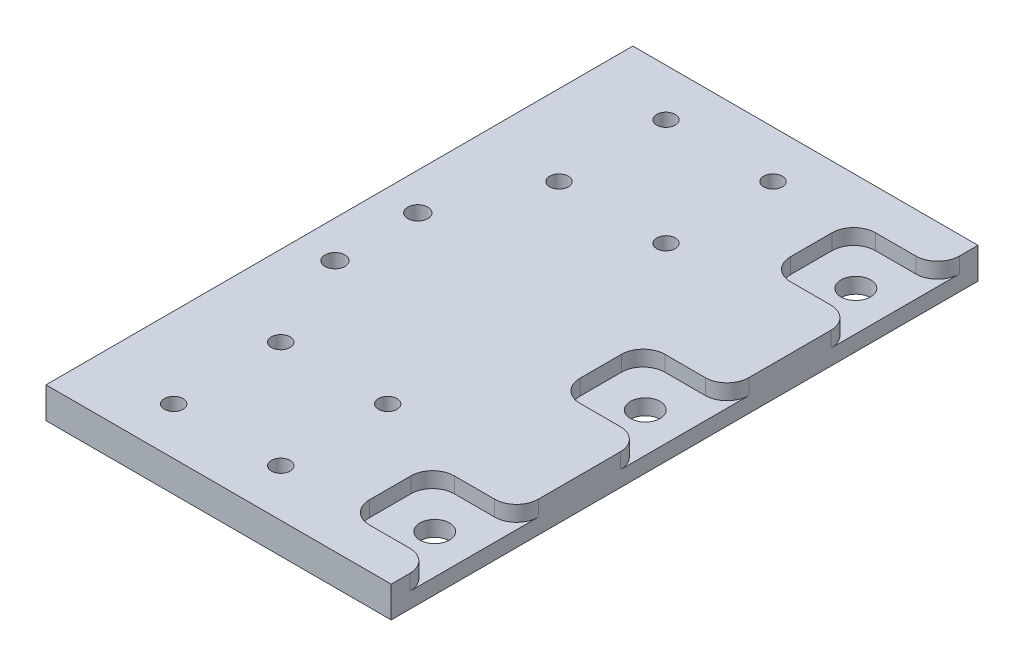
from build123d import *

# Parameters (mm, degrees)
SKETCH1_W                       = 50
SKETCH1_H                       = 95
BOSS_EXTRUDE1_DEPTH             = 2.25
M2_5_CLEARANCE_HOLE1_AT_2_COUNT = 2
M2_5_CLEARANCE_HOLE1_AT_2_PITCH = 15.5
M2_5_CLEARANCE_HOLE1_AT_3_COUNT = 2
M2_5_CLEARANCE_HOLE1_AT_3_PITCH = 21.920310217
M2_5_CLEARANCE_HOLE1_AT_4_COUNT = 2
M2_5_CLEARANCE_HOLE1_AT_4_PITCH = 15.5
SKETCH4_W                       = 50
SKETCH4_H                       = 5
CUT_EXTRUDE1_DEPTH              = 54.865573421
CUT_EXTRUDE2_DEPTH              = 2.25
M4_CLEARANCE_HOLE1_D            = 4.3
M4_CLEARANCE_HOLE1_DEPTH        = 10.1
M4_CLEARANCE_HOLE1_TIP          = 1.291850331
FILLET1_R                       = 3.1524
M2_5_CLEARANCE_HOLE2_D          = 2.9


with BuildPart() as part:
    # Sketch1 → Boss-Extrude1 (new, symmetric)
    with BuildSketch(Plane(origin=(0, 0, 0), x_dir=(1, 0, 0), z_dir=(0, 1, 0))):
        Rectangle(SKETCH1_W, SKETCH1_H)
    extrude(amount=BOSS_EXTRUDE1_DEPTH, both=True)

    # Sketch3 → M2.5 Clearance Hole1 (revolve, cut)
    with BuildSketch(Plane(origin=(2.15, 2.25, 20.15), x_dir=(0, 0, 1), z_dir=(1, 0, 0))):
        Polygon((0, 0), (0, 7.161161836), (1.35, 6.35), (1.35, 0), align=None)
    m2_5_clearance_hole1 = revolve(axis=Axis((2.15, 8.6, 20.15), (0, -1, 0)), mode=Mode.SUBTRACT)

    # M2.5 Clearance Hole1 at 2: M2.5 Clearance Hole1 ×2
    with Locations(*[(0, 0, i * M2_5_CLEARANCE_HOLE1_AT_2_PITCH) for i in range(1, M2_5_CLEARANCE_HOLE1_AT_2_COUNT)]):
        add(m2_5_clearance_hole1, mode=Mode.SUBTRACT)

    # M2.5 Clearance Hole1 at 3: M2.5 Clearance Hole1 ×2
    with Locations(*[Vector(-0.7071067811865477, 0, 0.7071067811865475) * (i * M2_5_CLEARANCE_HOLE1_AT_3_PITCH) for i in range(1, M2_5_CLEARANCE_HOLE1_AT_3_COUNT)]):
        add(m2_5_clearance_hole1, mode=Mode.SUBTRACT)

    # M2.5 Clearance Hole1 at 4: M2.5 Clearance Hole1 ×2
    with Locations(*[(-i * M2_5_CLEARANCE_HOLE1_AT_4_PITCH, 0, 0) for i in range(1, M2_5_CLEARANCE_HOLE1_AT_4_COUNT)]):
        add(m2_5_clearance_hole1, mode=Mode.SUBTRACT)

    # Sketch4 → Cut-Extrude1 (cut, through all)
    with BuildSketch(Plane(origin=(0, 2.25, 0), x_dir=(1, 0, 0), z_dir=(0, 1, 0))):
        with Locations((0, -45)):
            Rectangle(SKETCH4_W, SKETCH4_H)
    cut_extrude1 = extrude(amount=-CUT_EXTRUDE1_DEPTH, mode=Mode.SUBTRACT)

    # Mirror1: M2.5 Clearance Hole1, Cut-Extrude1 across plane
    add(m2_5_clearance_hole1.mirror(Plane.XY), mode=Mode.SUBTRACT)
    add(cut_extrude1.mirror(Plane.XY), mode=Mode.SUBTRACT)

    # Mirror1 copy 1 sketch → Mirror1 copy 1 (revolve, cut)
    with BuildSketch(Plane(origin=(2.15, 2.25, -35.65), x_dir=(0, 0, -1), z_dir=(1, 0, 0))):
        Polygon((0, 0), (0, -7.161161836), (1.35, -6.35), (1.35, 0), align=None)
    revolve(axis=Axis((2.15, 8.6, -35.65), (0, 1, 0)), mode=Mode.SUBTRACT)

    # Mirror1 copy 2 sketch → Mirror1 copy 2 (revolve, cut)
    with BuildSketch(Plane(origin=(-13.35, 2.25, -35.65), x_dir=(0, 0, -1), z_dir=(1, 0, 0))):
        Polygon((0, 0), (0, -7.161161836), (1.35, -6.35), (1.35, 0), align=None)
    revolve(axis=Axis((-13.35, 8.6, -35.65), (0, 1, 0)), mode=Mode.SUBTRACT)

    # Mirror1 copy 3 sketch → Mirror1 copy 3 (revolve, cut)
    with BuildSketch(Plane(origin=(-13.35, 2.25, -20.15), x_dir=(0, 0, -1), z_dir=(1, 0, 0))):
        Polygon((0, 0), (0, -7.161161836), (1.35, -6.35), (1.35, 0), align=None)
    revolve(axis=Axis((-13.35, 8.6, -20.15), (0, 1, 0)), mode=Mode.SUBTRACT)

    # Sketch5 → Cut-Extrude2 (cut)
    with BuildSketch(Plane(origin=(0, 2.25, 0), x_dir=(1, 0, 0), z_dir=(0, 1, 0))):
        with BuildLine():
            Line((25, -36.6524), (16, -36.6524))
            ThreePointArc((16, -36.6524), (13.770916583, -35.729083417), (12.8476, -33.5))
            Line((12.8476, -33.5), (12.8476, -27.5))
            ThreePointArc((12.8476, -27.5), (13.770916583, -25.270916583), (16, -24.3476))
            Line((16, -24.3476), (25, -24.3476))
            Line((25, -24.3476), (25, -36.6524))
        make_face()
        with BuildLine():
            Line((25, 6.1524), (25, -6.1524))
            Line((25, -6.1524), (16, -6.1524))
            ThreePointArc((16, -6.1524), (13.770916583, -5.229083417), (12.8476, -3))
            Line((12.8476, -3), (12.8476, 3))
            ThreePointArc((12.8476, 3), (13.770916583, 5.229083417), (16, 6.1524))
            Line((16, 6.1524), (25, 6.1524))
        make_face()
        with BuildLine():
            Line((25, 36.6524), (25, 24.3476))
            Line((25, 24.3476), (16, 24.3476))
            ThreePointArc((16, 24.3476), (13.770916583, 25.270916583), (12.8476, 27.5))
            Line((12.8476, 27.5), (12.8476, 33.5))
            ThreePointArc((12.8476, 33.5), (13.770916583, 35.729083417), (16, 36.6524))
            Line((16, 36.6524), (25, 36.6524))
        make_face()
    extrude(amount=-CUT_EXTRUDE2_DEPTH, mode=Mode.SUBTRACT)

    # M4 Clearance Hole1
    with Locations(Plane(origin=(0, 0, 0), x_dir=(1, 0, 0), z_dir=(0, 1, 0))):
        with Locations((19.3048, -30.5), (19.3048, 0), (19.3048, 30.5)):
            Hole(M4_CLEARANCE_HOLE1_D / 2, depth=M4_CLEARANCE_HOLE1_DEPTH)
            with Locations((0, 0, -(M4_CLEARANCE_HOLE1_DEPTH + M4_CLEARANCE_HOLE1_TIP / 2))):  # 118° drill point
                Cone(0, M4_CLEARANCE_HOLE1_D / 2, M4_CLEARANCE_HOLE1_TIP, mode=Mode.SUBTRACT)

    # Fillet1
    fillet1_edges = [part.edges().sort_by_distance(p)[0] for p in [
        (25, 1.125, 24.3476),
        (25, 1.125, 36.6524),
        (25, 1.125, 6.1524),
        (25, 1.125, -6.1524),
        (25, 1.125, -24.3476),
        (25, 1.125, -36.6524),
    ]]
    fillet(fillet1_edges, radius=FILLET1_R)

    # M2.5 Clearance Hole2 (through all)
    with Locations(Plane(origin=(0, -2.25, 0), x_dir=(-1, 0, 0), z_dir=(0, -1, 0))):
        with Locations((19.641987941, 6), (19.641987941, -6)):
            Hole(M2_5_CLEARANCE_HOLE2_D / 2)


solid = part.part
